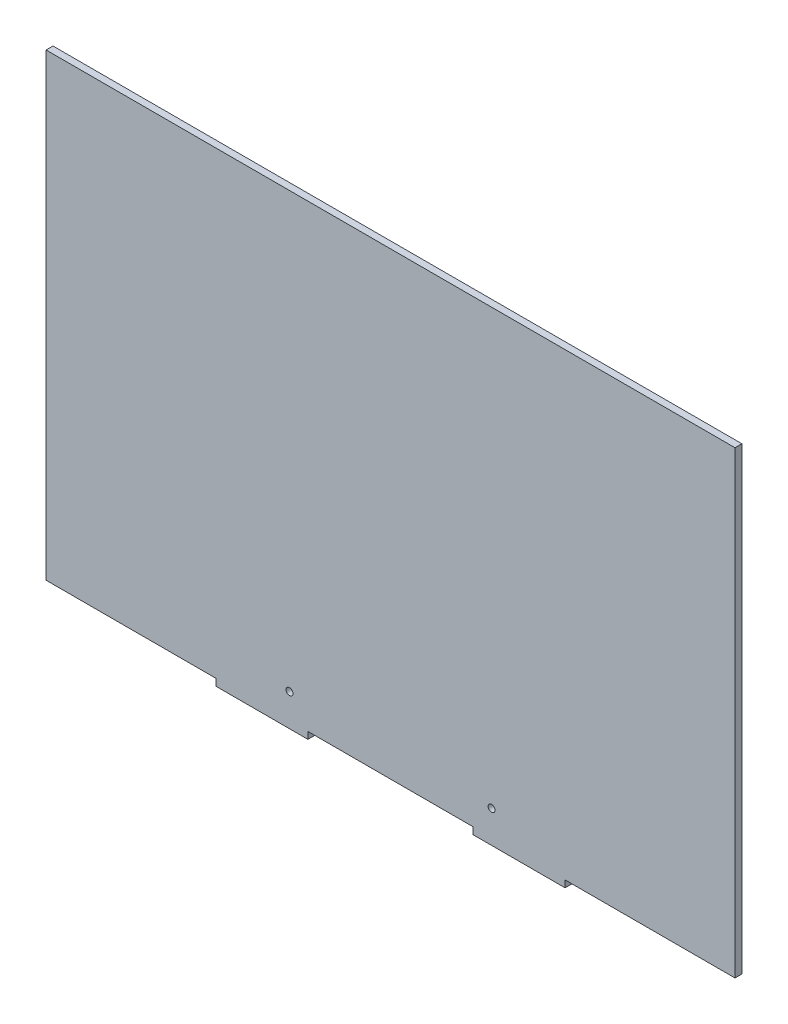
from build123d import *

# Parameters (mm, degrees)
RESSALTO_EXTRUS_O1_DEPTH = 3
ESBO_O2_R                = 1.5
CORTE_EXTRUS_O1_DEPTH    = 260.562958031


with BuildPart() as part:
    # Esboço1 → Ressalto-extrusão1 (new body)
    with BuildSketch(Plane.XY):
        Polygon((-58.046265604, -5.670353077), (13.953734396, -5.670353077), (13.953734396, -8.670353077), (53.953734396, -8.670353077), (53.953734396, -5.670353077), (127.953734396, -5.670353077), (127.953734396, 194.329646923), (-172.046265604, 194.329646923), (-172.046265604, -5.670353077), (-98.046265604, -5.670353077), (-98.046265604, -8.670353077), (-58.046265604, -8.670353077), align=None)
    extrude(amount=RESSALTO_EXTRUS_O1_DEPTH)

    # Esboço2 → Corte-extrusão1 (cut, through all)
    with BuildSketch(Plane.XY.offset(3)):
        with Locations((-66.046265604, 5.329646923)):
            Circle(ESBO_O2_R)
        with Locations((21.953734396, 5.329646923)):
            Circle(ESBO_O2_R)
    extrude(amount=-CORTE_EXTRUS_O1_DEPTH, mode=Mode.SUBTRACT)


solid = part.part
